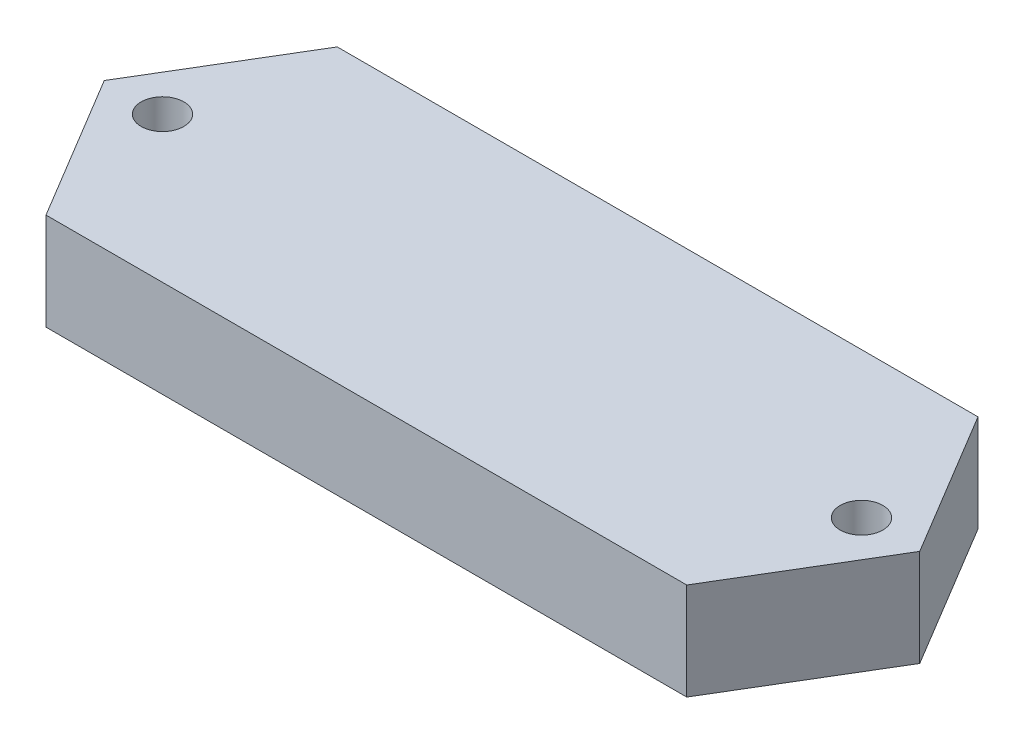
from build123d import *

# Parameters (mm, degrees)
SKETCH_1_W      = 33
SKETCH_1_H      = 15
SKETCH_1_R      = 1.1
EXTRUDE_1_DEPTH = 5


with BuildPart() as part:
    # 草图1 → 凸台-拉伸1 (new body)
    # profile 1 of 3: a face of its own
    with BuildSketch(Plane(origin=(0, 0, 0), x_dir=(1, 0, 0), z_dir=(0, 1, 0))):
        Rectangle(SKETCH_1_W, SKETCH_1_H)
    # profile 2 of 3: a face of its own
    with BuildSketch(Plane(origin=(0, 0, 0), x_dir=(1, 0, 0), z_dir=(0, 1, 0))):
        Polygon((-21, 0), (-16.5, 7.5), (-16.5, -7.5), align=None)
        with Locations(Location((-18, 0, 0), (0, 0, 270))):
            Circle(SKETCH_1_R, mode=Mode.SUBTRACT)
    # profile 3 of 3: a face of its own
    with BuildSketch(Plane(origin=(0, 0, 0), x_dir=(1, 0, 0), z_dir=(0, 1, 0))):
        Polygon((16.5, 7.5), (16.5, -7.5), (21, 0), align=None)
        with Locations(Location((18, 0, 0), (0, 0, 270))):
            Circle(SKETCH_1_R, mode=Mode.SUBTRACT)
    extrude(amount=EXTRUDE_1_DEPTH)


solid = part.part
